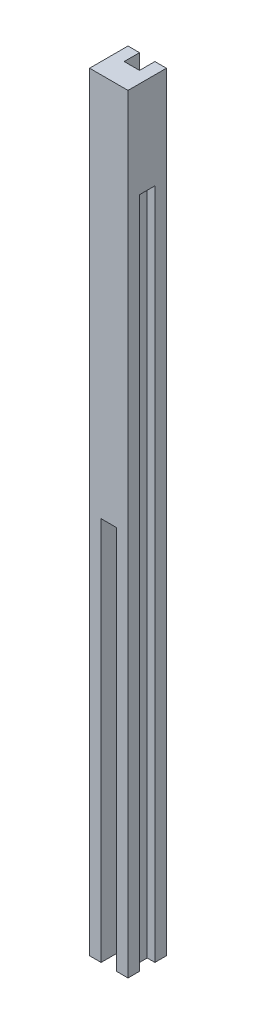
from build123d import *

# Parameters (mm, degrees)
SKETCH1_W           = 100
SKETCH1_H           = 100
BOSS_EXTRUDE1_DEPTH = 2000
SKETCH2_W           = 40
SKETCH2_H           = 1000
CUT_EXTRUDE1_DEPTH  = 40
SKETCH3_W           = 40
SKETCH3_H           = 1000
CUT_EXTRUDE2_DEPTH  = 40
SKETCH4_W           = 40
SKETCH4_H           = 1750
CUT_EXTRUDE3_DEPTH  = 20
SKETCH5_W           = 40
SKETCH5_H           = 1750
CUT_EXTRUDE4_DEPTH  = 20


with BuildPart() as part:
    # Sketch1 → Boss-Extrude1 (new body)
    with BuildSketch(Plane(origin=(0, 0, 0), x_dir=(1, 0, 0), z_dir=(0, 1, 0))):
        with Locations((6.50810977, -17.305559975)):
            Rectangle(SKETCH1_W, SKETCH1_H)
    extrude(amount=BOSS_EXTRUDE1_DEPTH)

    # Sketch2 → Cut-Extrude1 (cut)
    with BuildSketch(Plane.XY.offset(67.305559975)):
        with Locations((6.50810977, 500)):
            Rectangle(SKETCH2_W, SKETCH2_H)
    extrude(amount=-CUT_EXTRUDE1_DEPTH, mode=Mode.SUBTRACT)

    # Sketch3 → Cut-Extrude2 (cut)
    with BuildSketch(Plane(origin=(0, 0, -32.694440025), x_dir=(-1, 0, 0), z_dir=(0, 0, -1))):
        with Locations((-6.50810977, 1500)):
            Rectangle(SKETCH3_W, SKETCH3_H)
    extrude(amount=-CUT_EXTRUDE2_DEPTH, mode=Mode.SUBTRACT)

    # Sketch4 → Cut-Extrude3 (cut)
    with BuildSketch(Plane(origin=(56.50810977, 0, 0), x_dir=(0, 0, -1), z_dir=(1, 0, 0))):
        with Locations((-17.305559975, 875)):
            Rectangle(SKETCH4_W, SKETCH4_H)
    extrude(amount=-CUT_EXTRUDE3_DEPTH, mode=Mode.SUBTRACT)

    # Sketch5 → Cut-Extrude4 (cut)
    with BuildSketch(Plane.ZY.offset(43.49189023)):
        with Locations((17.305559975, 875)):
            Rectangle(SKETCH5_W, SKETCH5_H)
    extrude(amount=-CUT_EXTRUDE4_DEPTH, mode=Mode.SUBTRACT)


solid = part.part
